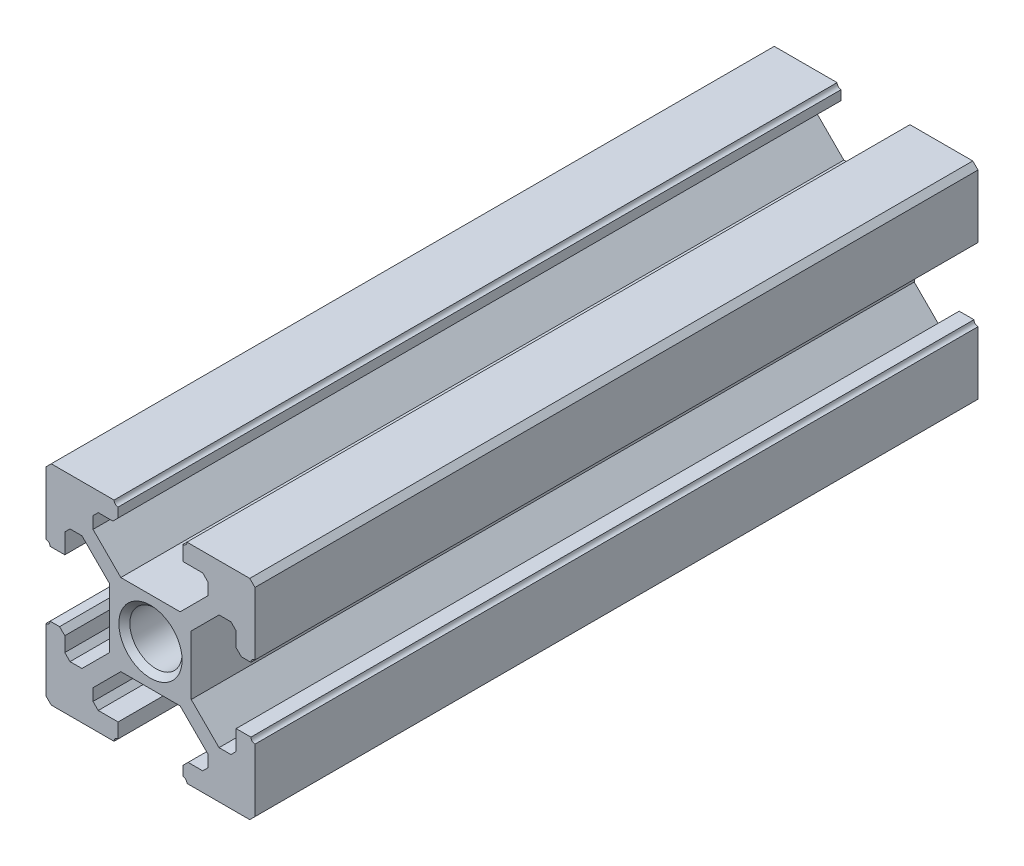
from build123d import *

# Parameters (mm, degrees)
BOSS_EXTRUDE1_DEPTH             = 69.2
M6X1_0_TAPPED_HOLE2_D           = 5
M6X1_0_TAPPED_HOLE2_DEPTH       = 28.497848452
M6X1_0_TAPPED_HOLE2_CSINK_D     = 6.05
M6X1_0_TAPPED_HOLE2_CSINK_ANGLE = 90
M6X1_0_TAPPED_HOLE2_TIP         = 1.502151548


with BuildPart() as part:
    # Sketch1 → Boss-Extrude1 (new body)
    with BuildSketch(Plane.XY):
        with BuildLine():
            Line((-9.5, 10), (-3.486470896, 10))
            ThreePointArc((-3.486470896, 10), (-3.373276191, 9.726723809), (-3.1, 9.613529104))
            Line((-3.1, 9.613529104), (-3.1, 8.7))
            Line((-3.1, 8.7), (-3.6, 8.2))
            Line((-3.6, 8.2), (-5, 8.2))
            Line((-5, 8.2), (-5.5, 7.7))
            Line((-5.5, 7.7), (-5.5, 6.560660172))
            Line((-5.5, 6.560660172), (-2.839339828, 3.9))
            Line((-2.839339828, 3.9), (0, 3.9))
            Line((0, 3.9), (2.839339828, 3.9))
            Line((2.839339828, 3.9), (5.5, 6.560660172))
            Line((5.5, 6.560660172), (5.5, 7.7))
            Line((5.5, 7.7), (5, 8.2))
            Line((5, 8.2), (3.1, 8.2))
            Line((3.1, 8.2), (3.1, 9.613529104))
            ThreePointArc((3.1, 9.613529104), (3.373276191, 9.726723809), (3.486470896, 10))
            Line((3.486470896, 10), (9.5, 10))
            Line((9.5, 10), (10, 9.5))
            Line((10, 9.5), (10, 3.486470896))
            ThreePointArc((10, 3.486470896), (9.726723809, 3.373276191), (9.613529104, 3.1))
            Line((9.613529104, 3.1), (8.7, 3.1))
            Line((8.7, 3.1), (8.2, 3.6))
            Line((8.2, 3.6), (8.2, 5))
            Line((8.2, 5), (7.7, 5.5))
            Line((7.7, 5.5), (6.560660172, 5.5))
            Line((6.560660172, 5.5), (3.9, 2.839339828))
            Line((3.9, 2.839339828), (3.9, 0))
            Line((3.9, 0), (3.9, -2.839339828))
            Line((3.9, -2.839339828), (6.560660172, -5.5))
            Line((6.560660172, -5.5), (7.7, -5.5))
            Line((7.7, -5.5), (8.2, -5))
            Line((8.2, -5), (8.2, -3.1))
            Line((8.2, -3.1), (9.613529104, -3.1))
            ThreePointArc((9.613529104, -3.1), (9.726723809, -3.373276191), (10, -3.486470896))
            Line((10, -3.486470896), (10, -9.5))
            Line((10, -9.5), (9.5, -10))
            Line((9.5, -10), (3.486470896, -10))
            ThreePointArc((3.486470896, -10), (3.373276191, -9.726723809), (3.1, -9.613529104))
            Line((3.1, -9.613529104), (3.1, -8.7))
            Line((3.1, -8.7), (3.6, -8.2))
            Line((3.6, -8.2), (5, -8.2))
            Line((5, -8.2), (5.5, -7.7))
            Line((5.5, -7.7), (5.5, -6.560660172))
            Line((5.5, -6.560660172), (2.839339828, -3.9))
            Line((2.839339828, -3.9), (0, -3.9))
            Line((0, -3.9), (-2.839339828, -3.9))
            Line((-2.839339828, -3.9), (-5.5, -6.560660172))
            Line((-5.5, -6.560660172), (-5.5, -7.7))
            Line((-5.5, -7.7), (-5, -8.2))
            Line((-5, -8.2), (-3.1, -8.2))
            Line((-3.1, -8.2), (-3.1, -9.613529104))
            ThreePointArc((-3.1, -9.613529104), (-3.373276191, -9.726723809), (-3.486470896, -10))
            Line((-3.486470896, -10), (-9.5, -10))
            Line((-9.5, -10), (-10, -9.5))
            Line((-10, -9.5), (-10, -3.486470896))
            ThreePointArc((-10, -3.486470896), (-9.726723809, -3.373276191), (-9.613529104, -3.1))
            Line((-9.613529104, -3.1), (-8.7, -3.1))
            Line((-8.7, -3.1), (-8.2, -3.6))
            Line((-8.2, -3.6), (-8.2, -5))
            Line((-8.2, -5), (-7.7, -5.5))
            Line((-7.7, -5.5), (-6.560660172, -5.5))
            Line((-6.560660172, -5.5), (-3.9, -2.839339828))
            Line((-3.9, -2.839339828), (-3.9, 0))
            Line((-3.9, 0), (-3.9, 2.839339828))
            Line((-3.9, 2.839339828), (-6.560660172, 5.5))
            Line((-6.560660172, 5.5), (-7.7, 5.5))
            Line((-7.7, 5.5), (-8.2, 5))
            Line((-8.2, 5), (-8.2, 3.1))
            Line((-8.2, 3.1), (-9.613529104, 3.1))
            ThreePointArc((-9.613529104, 3.1), (-9.726723809, 3.373276191), (-10, 3.486470896))
            Line((-10, 3.486470896), (-10, 9.5))
            Line((-10, 9.5), (-9.5, 10))
        make_face()
    extrude(amount=BOSS_EXTRUDE1_DEPTH)

    # Sketch2 → M6x1.0 Tapped Hole1 (revolve, cut)
    with BuildSketch(Plane(origin=(0, 0, 69.2), x_dir=(0, -1, 0), z_dir=(1, 0, 0))):
        Polygon((0, 0), (0, 30), (2.5, 28.497848452), (2.5, 0.525), (3.025, 0), align=None)
    revolve(axis=Axis((0, 0, 75.55), (0, 0, -1)), mode=Mode.SUBTRACT)

    # M6x1.0 Tapped Hole2
    with Locations(Plane(origin=(0, 0, 0), x_dir=(-1, 0, 0), z_dir=(0, 0, -1))):
        with Locations((0, 0)):
            CounterSinkHole(M6X1_0_TAPPED_HOLE2_D / 2, M6X1_0_TAPPED_HOLE2_CSINK_D / 2, depth=M6X1_0_TAPPED_HOLE2_DEPTH, counter_sink_angle=M6X1_0_TAPPED_HOLE2_CSINK_ANGLE)
            with Locations((0, 0, -(M6X1_0_TAPPED_HOLE2_DEPTH + M6X1_0_TAPPED_HOLE2_TIP / 2))):  # 118° drill point
                Cone(0, M6X1_0_TAPPED_HOLE2_D / 2, M6X1_0_TAPPED_HOLE2_TIP, mode=Mode.SUBTRACT)


solid = part.part
